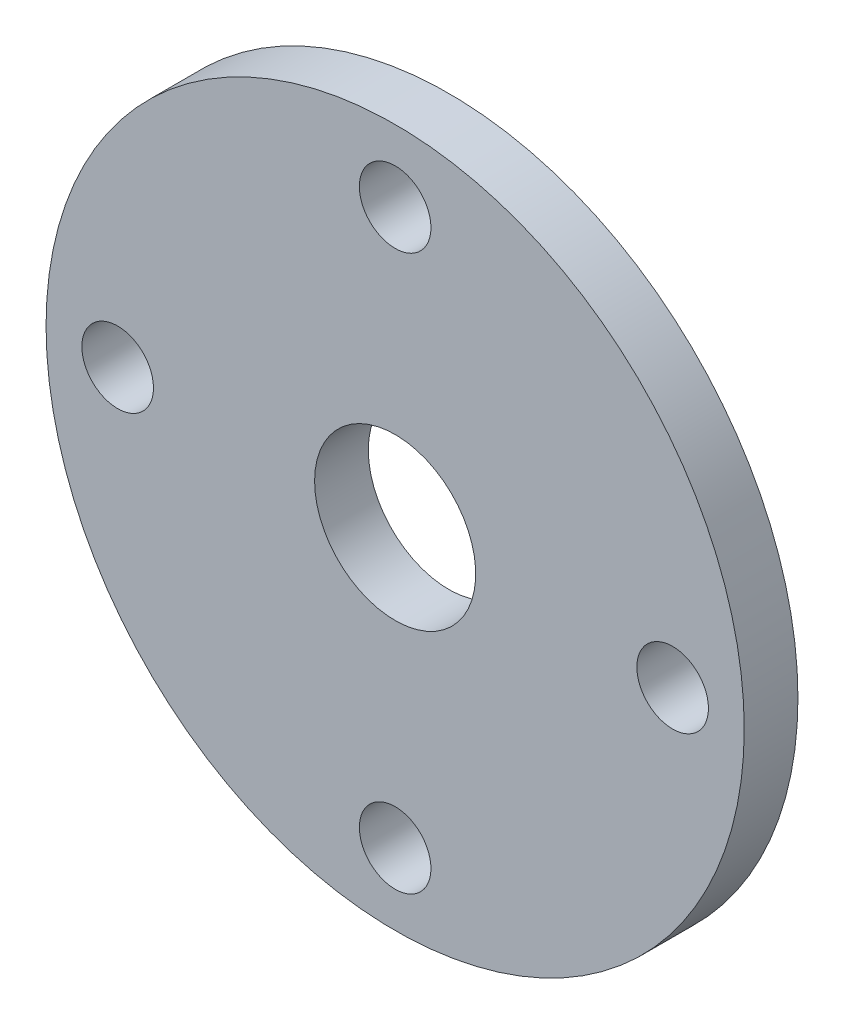
from build123d import *

# Parameters (mm, degrees)
CROQUIS1_R              = 19.5
CROQUIS1_R_2            = 2
SALIENTE_EXTRUIR1_DEPTH = 3
CROQUIS4_R              = 4.5
CORTAR_EXTRUIR1_DEPTH   = 1
CROQUIS4_2_R            = 4.5
CORTAR_EXTRUIR2_DEPTH   = 3


with BuildPart() as part:
    # Croquis1 → Saliente-Extruir1 (new body)
    with BuildSketch(Plane.XY):
        Circle(CROQUIS1_R)
        with Locations((0, -15.5)):
            Circle(CROQUIS1_R_2, mode=Mode.SUBTRACT)
        with Locations((15.5, 0)):
            Circle(CROQUIS1_R_2, mode=Mode.SUBTRACT)
        with Locations((0, 15.5)):
            Circle(CROQUIS1_R_2, mode=Mode.SUBTRACT)
        with Locations((-15.5, 0)):
            Circle(CROQUIS1_R_2, mode=Mode.SUBTRACT)
    extrude(amount=SALIENTE_EXTRUIR1_DEPTH)

    # Croquis4 → Cortar-Extruir1 (cut)
    with BuildSketch(Plane(origin=(0, 0, 0), x_dir=(-1, 0, 0), z_dir=(0, 0, -1))):
        Circle(CROQUIS4_R)
    extrude(amount=-CORTAR_EXTRUIR1_DEPTH, mode=Mode.SUBTRACT)

    # Croquis4<2> → Cortar-Extruir2 (cut)
    with BuildSketch(Plane(origin=(0, 0, 0), x_dir=(-1, 0, 0), z_dir=(0, 0, -1))):
        Circle(CROQUIS4_2_R)
    extrude(amount=-CORTAR_EXTRUIR2_DEPTH, mode=Mode.SUBTRACT)


solid = part.part
